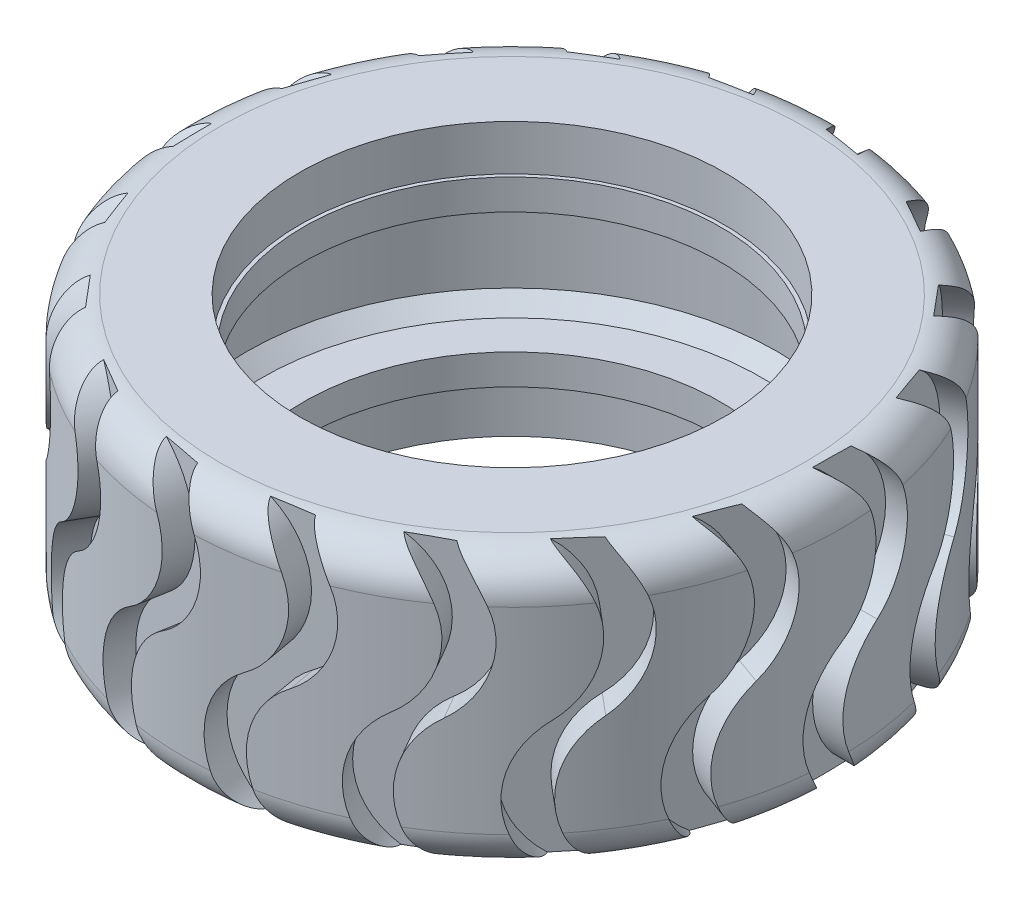
from build123d import *

# Parameters (mm, degrees)
SKETCH1_W       = 8
SKETCH1_H       = 18
FILLET1_R       = 2.5
TREAD_CUT_DEPTH = 2
TREADS_COUNT    = 18


with BuildPart() as part:
    # Sketch1 → Revolve1 (revolve)
    with BuildSketch(Plane(origin=(0, 0, 0), x_dir=(0, 0, -1), z_dir=(1, 0, 0))):
        with Locations((17.75, -9.388554217)):
            Rectangle(SKETCH1_W, SKETCH1_H)
    revolve(axis=Axis((0, -29.819277108, 0), (0, 1, 0)))

    # Sketch2 → Cut-Revolve1 (revolve, cut)
    with BuildSketch(Plane(origin=(0, 0, 0), x_dir=(0, 0, -1), z_dir=(1, 0, 0))):
        Polygon((14, -0.388554217), (14, -3.388554217), (13.75, -3.388554217), (13.75, -5.388554217), (16.5, -5.388554217), (17.5, -6.388554217), (17.5, -12.388554217), (16.5, -13.388554217), (13.75, -13.388554217), (13.75, -15.388554217), (14, -15.388554217), (14, -18.388554217), (10.75, -18.388554217), (10.75, -0.388554217), align=None)
    revolve(axis=Axis((0, -0.388554217, 0), (0, -1, 0)), mode=Mode.SUBTRACT)

    # Fillet1
    fillet1_edges = [part.edges().sort_by_distance(p)[0] for p in [
        (0, -18.388554217, 21.75),
        (0, -0.388554217, 21.75),
    ]]
    fillet(fillet1_edges, radius=FILLET1_R)

    # Sketch3 → Tread-cut (cut)
    with BuildSketch(Plane(origin=(21.75, 0, 0), x_dir=(0, 0, -1), z_dir=(1, 0, 0))):
        with BuildLine():
            Line((0, -0.388554217), (2.5, -0.388554217))
            ThreePointArc((2.5, -0.388554217), (4.908326913, -4.888554217), (2.5, -9.388554217))
            ThreePointArc((2.5, -9.388554217), (0.091673087, -13.888554217), (2.5, -18.388554217))
            Line((2.5, -18.388554217), (0, -18.388554217))
            ThreePointArc((0, -18.388554217), (-2.408326913, -13.888554217), (0, -9.388554217))
            ThreePointArc((0, -9.388554217), (2.408326913, -4.888554217), (0, -0.388554217))
        make_face()
    tread_cut = extrude(amount=-TREAD_CUT_DEPTH, mode=Mode.SUBTRACT)

    # Treads: Tread-cut ×18 about axis
    treads_axis = Axis((0, 0.511445783, 0), (0, -1, 0))
    for i in range(1, TREADS_COUNT):
        add(tread_cut.rotate(treads_axis, i * 360 / TREADS_COUNT), mode=Mode.SUBTRACT)


solid = part.part
